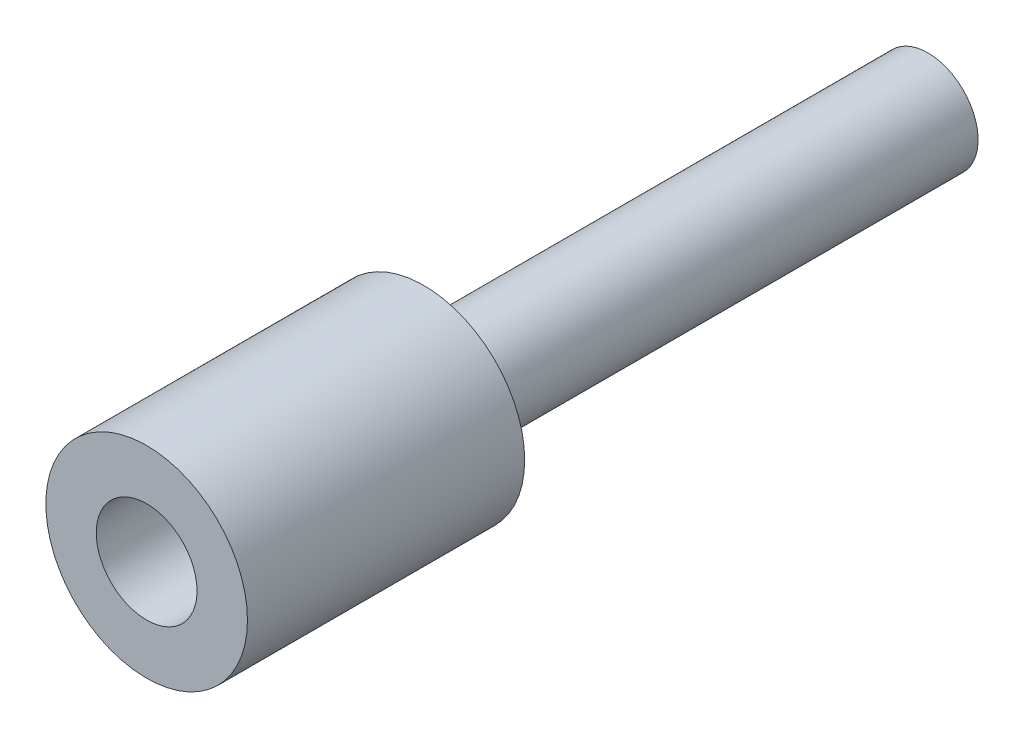
from build123d import *

# Parameters (mm, degrees)
SKETCH1_R           = 4
SKETCH1_R_2         = 2
BOSS_EXTRUDE1_DEPTH = 11
SKETCH2_R           = 1.990334505
BOSS_EXTRUDE2_DEPTH = 20


with BuildPart() as part:
    # Sketch1 → Boss-Extrude1 (new body)
    with BuildSketch(Plane.XY):
        Circle(SKETCH1_R)
        Circle(SKETCH1_R_2, mode=Mode.SUBTRACT)
    extrude(amount=BOSS_EXTRUDE1_DEPTH)


with BuildPart() as body_2:
    # Sketch2 → Boss-Extrude2 (new body)
    with BuildSketch(Plane(origin=(0, 0, 0), x_dir=(-1, 0, 0), z_dir=(0, 0, -1))):
        Circle(SKETCH2_R)
    extrude(amount=BOSS_EXTRUDE2_DEPTH)


solid = Compound([part.part, body_2.part])
